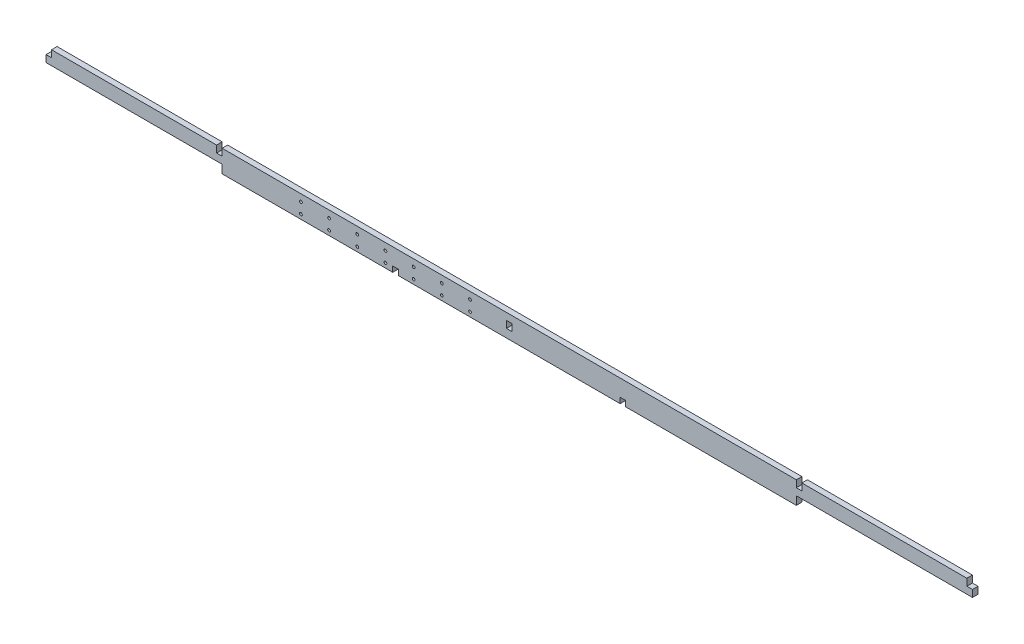
from build123d import *

# Parameters (mm, degrees)
SKETCH1_W           = 10.05
SKETCH1_H           = 12.5
BOSS_EXTRUDE1_DEPTH = 10
SKETCH2_R           = 2.5
CUT_EXTRUDE1_DEPTH  = 836.29934754


with BuildPart() as part:
    # Sketch1 → Boss-Extrude1 (new body)
    with BuildSketch(Plane.XY):
        Polygon((517.5, 20), (-517.5, 20), (-517.5, 7.5), (-527.5, 7.5), (-527.5, 20), (-825, 20), (-825, 7.5), (-835, 7.5), (-835, -5), (-517.5, -5), (-517.5, -20), (-210, -20), (-210, -10), (-200, -10), (-200, -20), (200, -20), (200, -10), (210, -10), (210, -20), (517.5, -20), (517.5, -5), (835, -5), (835, 7.5), (825, 7.5), (825, 20), (527.5, 20), (527.5, 7.5), (517.5, 7.5), align=None)
        with Locations((0.025, 1.25)):
            Rectangle(SKETCH1_W, SKETCH1_H, mode=Mode.SUBTRACT)
    extrude(amount=BOSS_EXTRUDE1_DEPTH)

    # Sketch2 → Cut-Extrude1 (cut, through all)
    with BuildSketch(Plane.XY.offset(10)):
        with Locations((-375.5, 7.3)):
            Circle(SKETCH2_R)
        with Locations((-375.5, -11.75)):
            Circle(SKETCH2_R)
        with Locations((-324.7, -11.75)):
            Circle(SKETCH2_R)
        with Locations((-324.7, 7.3)):
            Circle(SKETCH2_R)
        with Locations((-273.9, 7.3)):
            Circle(SKETCH2_R)
        with Locations((-273.9, -11.75)):
            Circle(SKETCH2_R)
        with Locations((-223.1, -11.75)):
            Circle(SKETCH2_R)
        with Locations((-223.1, 7.3)):
            Circle(SKETCH2_R)
        with Locations((-172.3, 7.3)):
            Circle(SKETCH2_R)
        with Locations((-121.5, -11.75)):
            Circle(SKETCH2_R)
        with Locations((-121.5, 7.3)):
            Circle(SKETCH2_R)
        with Locations((-70.7, 7.3)):
            Circle(SKETCH2_R)
        with Locations((-70.7, -11.75)):
            Circle(SKETCH2_R)
        with Locations((-172.3, -11.75)):
            Circle(SKETCH2_R)
    extrude(amount=-CUT_EXTRUDE1_DEPTH, mode=Mode.SUBTRACT)


solid = part.part
